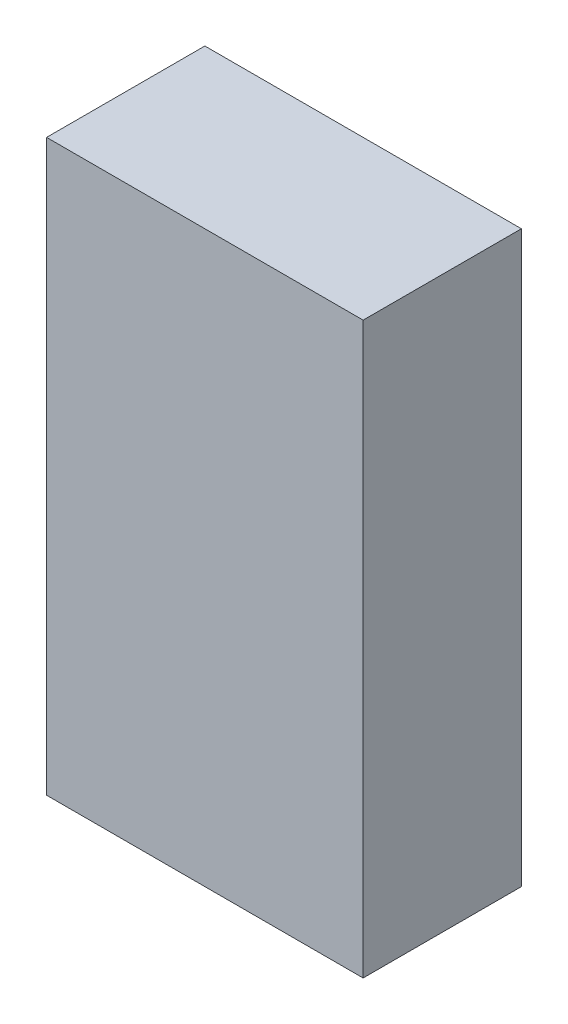
from build123d import *

# Parameters (mm, degrees)
SKETCH1_W           = 10
SKETCH1_H           = 18
BOSS_EXTRUDE1_DEPTH = 5


with BuildPart() as part:
    # Sketch1 → Boss-Extrude1 (new body)
    with BuildSketch(Plane.XY):
        Rectangle(SKETCH1_W, SKETCH1_H)
    extrude(amount=BOSS_EXTRUDE1_DEPTH)


solid = part.part
